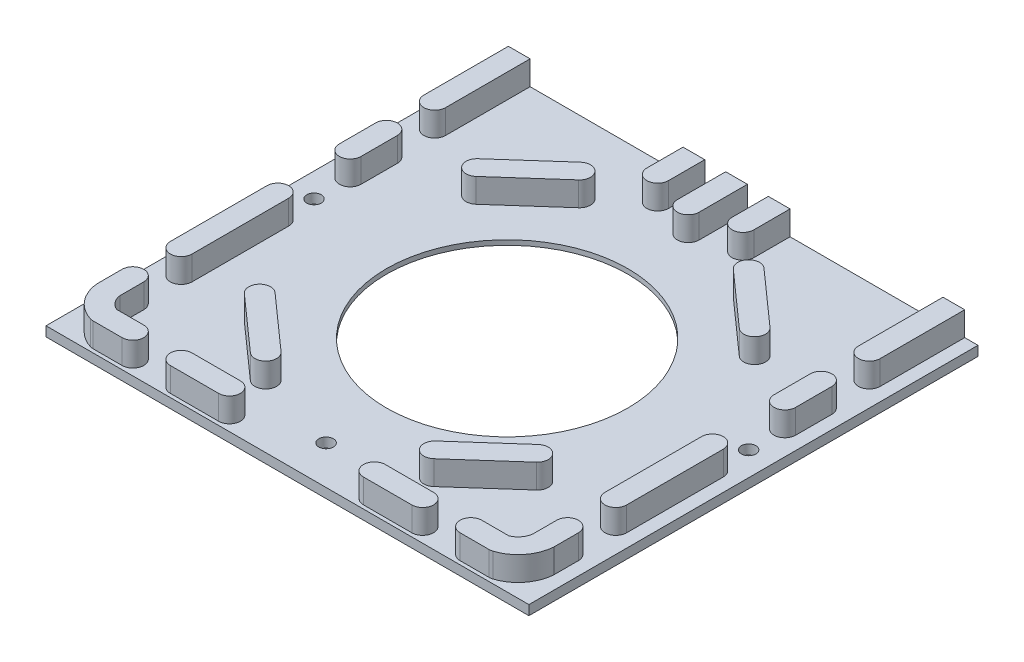
from build123d import *

# Parameters (mm, degrees)
SKETCH1_W           = 200
SKETCH1_H           = 190
BOSS_EXTRUDE1_DEPTH = 4
BOSS_EXTRUDE2_DEPTH = 10
SKETCH4_R           = 50
CUT_EXTRUDE1_DEPTH  = 10
SKETCH9_W           = 200
SKETCH9_H           = 4
CUT_EXTRUDE6_DEPTH  = 12
SKETCH12_R          = 57.5
CUT_EXTRUDE7_DEPTH  = 2
SKETCH10_R          = 3
CUT_EXTRUDE8_DEPTH  = 10
CUT_EXTRUDE9_DEPTH  = 10


with BuildPart() as part:
    # Sketch1 → Boss-Extrude1 (new body)
    with BuildSketch(Plane(origin=(0, 0, 0), x_dir=(1, 0, 0), z_dir=(0, 1, 0))):
        with Locations((100, 95)):
            Rectangle(SKETCH1_W, SKETCH1_H)
    extrude(amount=BOSS_EXTRUDE1_DEPTH)

    # Sketch3 → Boss-Extrude2 (add)
    with BuildSketch(Plane(origin=(0, 4, 0), x_dir=(1, 0, 0), z_dir=(0, 1, 0))):
        with BuildLine():
            Line((30, 14.5), (18.788441151, 14.5))
            ThreePointArc((18.788441151, 14.5), (15.870102337, 16.769618143), (14.5, 20.203375202))
            Line((14.5, 20.203375202), (14.5, 30))
            ThreePointArc((14.5, 30), (10, 34.5), (5.5, 30))
            Line((5.5, 30), (5.5, 20.135411686))
            ThreePointArc((5.5, 20.135411686), (5.499816866, 19.870814738), (5.515185448, 19.60666443))
            ThreePointArc((5.515185448, 19.60666443), (8.973335462, 10.97845936), (16.633299171, 5.712561506))
            ThreePointArc((16.633299171, 5.712561506), (17.308434105, 5.553457904), (18, 5.5))
            Line((18, 5.5), (30, 5.5))
            ThreePointArc((30, 5.5), (34.5, 10), (30, 14.5))
        make_face()
        with BuildLine():
            Line((14.5, 190), (5.5, 190))
            Line((5.5, 190), (5.5, 155))
            ThreePointArc((5.5, 155), (10, 150.5), (14.5, 155))
            Line((14.5, 155), (14.5, 190))
        make_face()
        with BuildLine():
            Line((194.5, 155), (194.5, 190))
            Line((194.5, 190), (185.5, 190))
            Line((185.5, 190), (185.5, 155))
            ThreePointArc((185.5, 155), (190, 150.5), (194.5, 155))
        make_face()
        with BuildLine():
            Line((86.835483589, 190), (77.835483589, 190))
            Line((77.835483589, 190), (77.835483589, 175))
            ThreePointArc((77.835483589, 175), (82.335483589, 170.5), (86.835483589, 175))
            Line((86.835483589, 175), (86.835483589, 190))
        make_face()
        with BuildLine():
            Line((122.164516411, 175), (122.164516411, 190))
            Line((122.164516411, 190), (113.164516411, 190))
            Line((113.164516411, 190), (113.164516411, 175))
            ThreePointArc((113.164516411, 175), (117.664516411, 170.5), (122.164516411, 175))
        make_face()
        with BuildLine():
            Line((104.5, 190), (95.5, 190))
            Line((95.5, 190), (95.5, 170))
            ThreePointArc((95.5, 170), (100, 165.5), (104.5, 170))
            Line((104.5, 170), (104.5, 190))
        make_face()
        with BuildLine():
            Line((5.5, 90), (5.5, 50))
            ThreePointArc((5.5, 50), (10, 45.5), (14.5, 50))
            Line((14.5, 50), (14.5, 90))
            ThreePointArc((14.5, 90), (10, 94.5), (5.5, 90))
        make_face()
        with BuildLine():
            Line((70, 14.5), (50, 14.5))
            ThreePointArc((50, 14.5), (45.5, 10), (50, 5.5))
            Line((50, 5.5), (70, 5.5))
            ThreePointArc((70, 5.5), (74.5, 10), (70, 14.5))
        make_face()
        with BuildLine():
            ThreePointArc((185.5, 50), (190, 45.5), (194.5, 50))
            Line((194.5, 50), (194.5, 90))
            ThreePointArc((194.5, 90), (190, 94.5), (185.5, 90))
            Line((185.5, 90), (185.5, 50))
        make_face()
        with BuildLine():
            ThreePointArc((185.5, 20.203375202), (184.129897663, 16.769618143), (181.211558849, 14.5))
            Line((181.211558849, 14.5), (170, 14.5))
            ThreePointArc((170, 14.5), (165.5, 10), (170, 5.5))
            Line((170, 5.5), (182, 5.5))
            ThreePointArc((182, 5.5), (182.691565895, 5.553457904), (183.366700829, 5.712561506))
            ThreePointArc((183.366700829, 5.712561506), (191.026664538, 10.97845936), (194.484814552, 19.60666443))
            ThreePointArc((194.484814552, 19.60666443), (194.500183134, 19.870814738), (194.5, 20.135411686))
            Line((194.5, 20.135411686), (194.5, 30))
            ThreePointArc((194.5, 30), (190, 34.5), (185.5, 30))
            Line((185.5, 30), (185.5, 20.203375202))
        make_face()
        with BuildLine():
            ThreePointArc((150, 5.5), (154.5, 10), (150, 14.5))
            Line((150, 14.5), (130, 14.5))
            ThreePointArc((130, 14.5), (125.5, 10), (130, 5.5))
            Line((130, 5.5), (150, 5.5))
        make_face()
        with BuildLine():
            ThreePointArc((160.489637275, 46.636658066), (160.863341934, 52.989637275), (154.510362725, 53.363341934))
            Line((154.510362725, 53.363341934), (132.010362725, 33.363341934))
            ThreePointArc((132.010362725, 33.363341934), (131.636658066, 27.010362725), (137.989637275, 26.636658066))
            Line((137.989637275, 26.636658066), (160.489637275, 46.636658066))
        make_face()
        with BuildLine():
            Line((132.010362725, 156.636658066), (154.510362725, 136.636658066))
            ThreePointArc((154.510362725, 136.636658066), (160.863341934, 137.010362725), (160.489637275, 143.363341934))
            Line((160.489637275, 143.363341934), (137.989637275, 163.363341934))
            ThreePointArc((137.989637275, 163.363341934), (131.636658066, 162.989637275), (132.010362725, 156.636658066))
        make_face()
        with BuildLine():
            Line((5.5, 135), (5.5, 120))
            ThreePointArc((5.5, 120), (10, 115.5), (14.5, 120))
            Line((14.5, 120), (14.5, 135))
            ThreePointArc((14.5, 135), (10, 139.5), (5.5, 135))
        make_face()
        with BuildLine():
            ThreePointArc((39.510362725, 143.363341934), (39.136658066, 137.010362725), (45.489637275, 136.636658066))
            Line((45.489637275, 136.636658066), (67.989637275, 156.636658066))
            ThreePointArc((67.989637275, 156.636658066), (68.363341934, 162.989637275), (62.010362725, 163.363341934))
            Line((62.010362725, 163.363341934), (39.510362725, 143.363341934))
        make_face()
        with BuildLine():
            Line((67.989637275, 33.363341934), (45.489637275, 53.363341934))
            ThreePointArc((45.489637275, 53.363341934), (39.136658066, 52.989637275), (39.510362725, 46.636658066))
            Line((39.510362725, 46.636658066), (62.010362725, 26.636658066))
            ThreePointArc((62.010362725, 26.636658066), (68.363341934, 27.010362725), (67.989637275, 33.363341934))
        make_face()
        with BuildLine():
            ThreePointArc((185.5, 120), (190, 115.5), (194.5, 120))
            Line((194.5, 120), (194.5, 135))
            ThreePointArc((194.5, 135), (190, 139.5), (185.5, 135))
            Line((185.5, 135), (185.5, 120))
        make_face()
    extrude(amount=BOSS_EXTRUDE2_DEPTH)

    # Sketch4 → Cut-Extrude1 (cut)
    with BuildSketch(Plane(origin=(0, 0, 0), x_dir=(1, 0, 0), z_dir=(0, 1, 0))):
        with Locations(Location((100, 95, 0), (0, 0, 90))):
            Circle(SKETCH4_R)
    extrude(amount=CUT_EXTRUDE1_DEPTH, mode=Mode.SUBTRACT)

    # Sketch9 → Cut-Extrude6 (cut)
    with BuildSketch(Plane.XZ):
        with Locations((100, -2)):
            Rectangle(SKETCH9_W, SKETCH9_H)
    extrude(amount=-CUT_EXTRUDE6_DEPTH, mode=Mode.SUBTRACT)

    # Sketch12 → Cut-Extrude7 (cut)
    with BuildSketch(Plane(origin=(0, 0, 0), x_dir=(-1, 0, 0), z_dir=(0, -1, 0))):
        with Locations(Location((-100, 95, 0), (0, 0, 90))):
            Circle(SKETCH12_R)
    extrude(amount=-CUT_EXTRUDE7_DEPTH, mode=Mode.SUBTRACT)

    # Sketch10 → Cut-Extrude8 (cut)
    with BuildSketch(Plane(origin=(0, 4, 0), x_dir=(1, 0, 0), z_dir=(0, 1, 0))):
        with Locations(Location((10, 105, 0), (0, 0, 270))):
            Circle(SKETCH10_R)
        with Locations(Location((100, 20, 0), (0, 0, 270))):
            Circle(SKETCH10_R)
        with Locations(Location((190, 105, 0), (0, 0, 90))):
            Circle(SKETCH10_R)
    extrude(amount=-CUT_EXTRUDE8_DEPTH, mode=Mode.SUBTRACT)

    # Sketch13 → Cut-Extrude9 (cut)
    with BuildSketch(Plane.XZ):
        with BuildLine():
            ThreePointArc((49.5, -147.5), (48.914213562, -146.085786438), (47.5, -145.5))
            Line((47.5, -145.5), (47.5, -147.5))
            Line((47.5, -147.5), (49.5, -147.5))
        make_face()
        with BuildLine():
            Line((47.5, -147.5), (47.5, -145.5))
            ThreePointArc((47.5, -145.5), (46.085786438, -148.914213562), (49.5, -147.5))
            Line((49.5, -147.5), (47.5, -147.5))
        make_face()
        with BuildLine():
            ThreePointArc((47.5, -44.5021719), (48.914213562, -43.916385462), (49.5, -42.5021719))
            Line((49.5, -42.5021719), (47.5, -42.5021719))
            Line((47.5, -42.5021719), (47.5, -44.5021719))
        make_face()
        with BuildLine():
            Line((47.5, -42.5021719), (49.5, -42.5021719))
            ThreePointArc((49.5, -42.5021719), (46.085786438, -41.087958338), (47.5, -44.5021719))
            Line((47.5, -44.5021719), (47.5, -42.5021719))
        make_face()
        with BuildLine():
            ThreePointArc((154.4978281, -42.5021719), (152.4978281, -40.5021719), (150.4978281, -42.5021719))
            Line((150.4978281, -42.5021719), (152.4978281, -42.5021719))
            Line((152.4978281, -42.5021719), (152.4978281, -44.5021719))
            ThreePointArc((152.4978281, -44.5021719), (153.912041662, -43.916385462), (154.4978281, -42.5021719))
        make_face()
        with BuildLine():
            Line((152.4978281, -42.5021719), (150.4978281, -42.5021719))
            ThreePointArc((150.4978281, -42.5021719), (151.083614538, -43.916385462), (152.4978281, -44.5021719))
            Line((152.4978281, -44.5021719), (152.4978281, -42.5021719))
        make_face()
        with BuildLine():
            ThreePointArc((154.4978281, -147.5), (153.912041662, -146.085786438), (152.4978281, -145.5))
            Line((152.4978281, -145.5), (152.4978281, -147.5))
            Line((152.4978281, -147.5), (150.4978281, -147.5))
            ThreePointArc((150.4978281, -147.5), (152.4978281, -149.5), (154.4978281, -147.5))
        make_face()
        with BuildLine():
            Line((152.4978281, -147.5), (152.4978281, -145.5))
            ThreePointArc((152.4978281, -145.5), (151.083614538, -146.085786438), (150.4978281, -147.5))
            Line((150.4978281, -147.5), (152.4978281, -147.5))
        make_face()
    extrude(amount=-CUT_EXTRUDE9_DEPTH, mode=Mode.SUBTRACT)


solid = part.part
